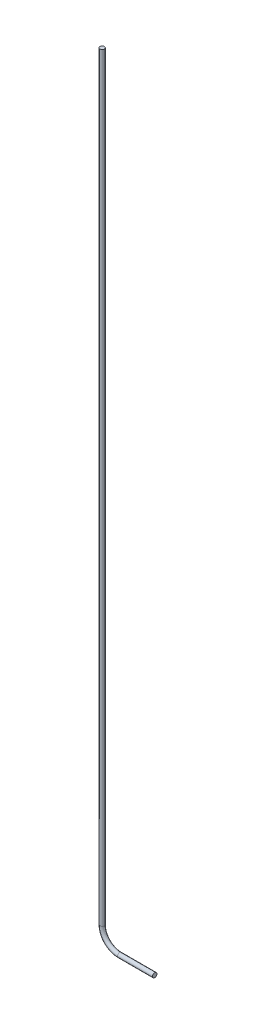
from build123d import *

# Parameters (mm, degrees)
SWEEP1_PROFILE_R = 6.35


with BuildPart() as part:
    # Sweep1: sweep along a path in Sketch1
    with BuildLine(Plane.XY) as sweep1_path:
        Line((0, 2253.996), (0, 50.8))
        ThreePointArc((0, 50.8), (14.878975516, 14.878975516), (50.8, 0))
        Line((50.8, 0), (152.4, 0))
    # Sweep1 profile (on start of the path) → Sweep1 (sweep)
    with BuildSketch(Plane(origin=(0, 2253.996, 0), x_dir=(0, 0, -1), z_dir=(0, -1, 0))):
        Circle(SWEEP1_PROFILE_R)
    sweep(path=sweep1_path.line)


solid = part.part
